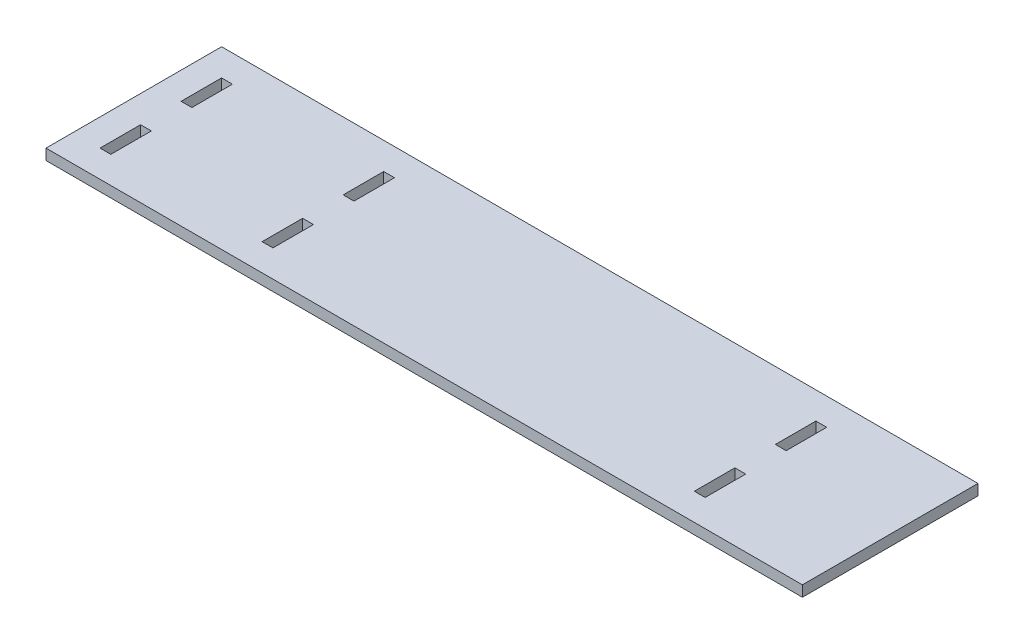
from build123d import *

# Parameters (mm, degrees)
SKETCH1_W           = 280
SKETCH1_H           = 65
BOSS_EXTRUDE1_DEPTH = 4
SKETCH2_W           = 4
SKETCH2_H           = 15
CUT_EXTRUDE1_DEPTH  = 4


with BuildPart() as part:
    # Sketch1 → Boss-Extrude1 (new body)
    with BuildSketch(Plane(origin=(0, 0, 0), x_dir=(1, 0, 0), z_dir=(0, 1, 0))):
        with Locations((140, 32.5)):
            Rectangle(SKETCH1_W, SKETCH1_H)
    extrude(amount=BOSS_EXTRUDE1_DEPTH)

    # Sketch2 → Cut-Extrude1 (cut)
    with BuildSketch(Plane(origin=(0, 4, 0), x_dir=(1, 0, 0), z_dir=(0, 1, 0))):
        with Locations((12, 47.5)):
            Rectangle(SKETCH2_W, SKETCH2_H)
        with Locations((12, 17.5)):
            Rectangle(SKETCH2_W, SKETCH2_H)
        with Locations((72, 17.5)):
            Rectangle(SKETCH2_W, SKETCH2_H)
        with Locations((72, 47.5)):
            Rectangle(SKETCH2_W, SKETCH2_H)
        with Locations((232, 47.5)):
            Rectangle(SKETCH2_W, SKETCH2_H)
        with Locations((232, 17.5)):
            Rectangle(SKETCH2_W, SKETCH2_H)
    extrude(amount=-CUT_EXTRUDE1_DEPTH, mode=Mode.SUBTRACT)


solid = part.part
